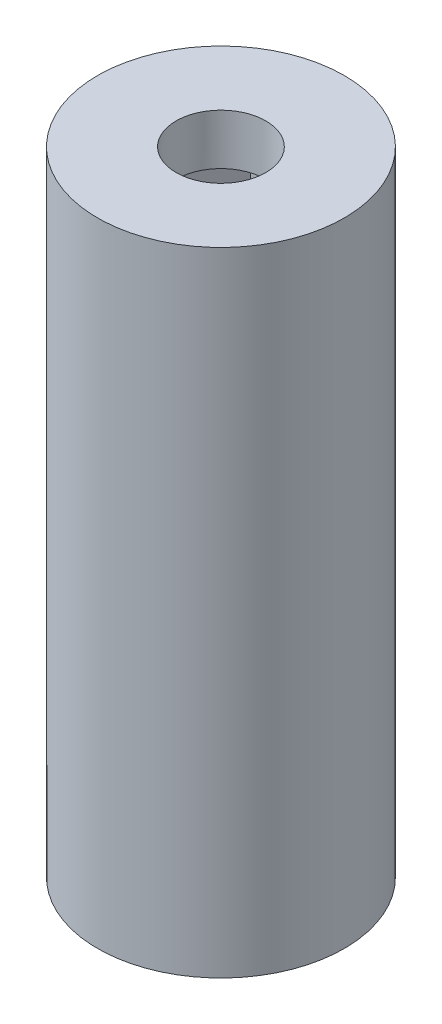
from build123d import *

# Parameters (mm, degrees)
CUT_EXTRUDE2_DEPTH   = 23.368
M3_CLEARANCE_HOLE1_D = 3.6
SKETCH10_OUTSIDE_W   = 29.468
SKETCH10_OUTSIDE_H   = 29.468
SKETCH10_OUTSIDE_R   = 4.953
CUT_EXTRUDE3_DEPTH   = 30.033261092


with BuildPart() as part:
    # Sketch1 → Revolve1 (revolve)
    with BuildSketch(Plane(origin=(0, 0, 0), x_dir=(0, 0, -1), z_dir=(1, 0, 0))):
        Polygon((0, 25.4), (9.9441, 25.4), (9.9441, 23.368), (4.953, 23.368), (4.953, 0), (0, 0), align=None)
    revolve(axis=Axis((0, 0, 0), (0, 1, 0)))

    # Sketch4 → Cut-Extrude2 (cut)
    with BuildSketch(Plane.XZ):
        Polygon((1.613116652, -2.794), (3.226233304, 0), (1.613116652, 2.794), (-1.613116652, 2.794), (-3.226233304, 0), (-1.613116652, -2.794), align=None)
    extrude(amount=-CUT_EXTRUDE2_DEPTH, mode=Mode.SUBTRACT)

    # M3 Clearance Hole1 (through all)
    with Locations(Plane(origin=(0, 25.4, 0), x_dir=(1, 0, 0), z_dir=(0, 1, 0))):
        with Locations((-6.985, 0), (0, 0), (6.985, 0), (0, 6.985), (0, -6.985)):
            Hole(M3_CLEARANCE_HOLE1_D / 2)

    # Sketch10 outside → Cut-Extrude3 (cut, through all)
    with BuildSketch(Plane.XZ):
        Rectangle(SKETCH10_OUTSIDE_W, SKETCH10_OUTSIDE_H)
        with Locations(Location((0, 0, 0), (0, 0, 270))):
            Circle(SKETCH10_OUTSIDE_R, mode=Mode.SUBTRACT)
    extrude(amount=-CUT_EXTRUDE3_DEPTH, mode=Mode.SUBTRACT)


solid = part.part
